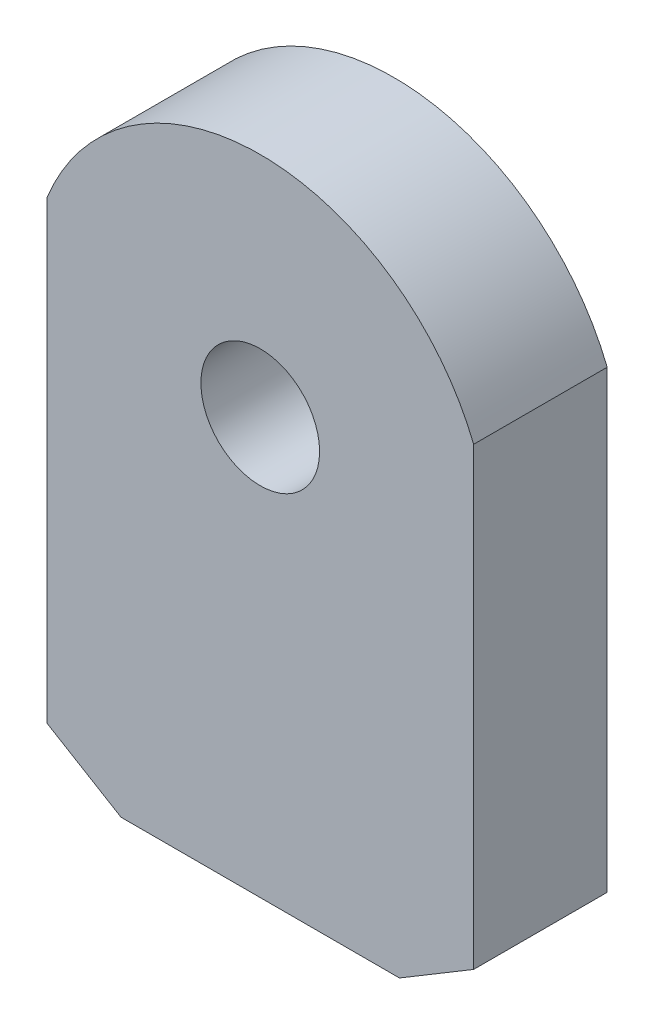
from build123d import *

# Parameters (mm, degrees)
SKETCH_1_R      = 4
EXTRUDE_1_DEPTH = 9
CHAMFER_1_SIZE  = 5
CHAMFER_1_SIZE2 = 3
CHAMFER_2_SIZE  = 3
CHAMFER_2_SIZE2 = 5


with BuildPart() as part:
    # ｽｹｯﾁ1 → ﾎﾞｽ - 押し出し1 (new body)
    with BuildSketch(Plane.XY):
        with BuildLine():
            Line((14.385, -28.04), (-14.385, -28.04))
            Line((-14.385, -28.04), (-14.385, -5.612501624))
            Line((-14.385, -5.612501624), (-14.385, 5.612501624))
            ThreePointArc((-14.385, 5.612501624), (0, 15.34), (14.385, 5.612501624))
            Line((14.385, 5.612501624), (14.385, -5.612501624))
            Line((14.385, -5.612501624), (14.385, -28.04))
        make_face()
        Circle(SKETCH_1_R, mode=Mode.SUBTRACT)
    extrude(amount=EXTRUDE_1_DEPTH)

    # 面取り1
    chamfer_1_edges = [part.edges().sort_by_distance(p)[0] for p in [
        (14.385, -28.04, 4.5),
    ]]
    chamfer_1_side = [part.faces().sort_by_distance(p)[0] for p in [
        (0, -28.04, 4.5),
    ]]
    chamfer(chamfer_1_edges, length=CHAMFER_1_SIZE, length2=CHAMFER_1_SIZE2, reference=chamfer_1_side[0])

    # 面取り2
    chamfer_2_edges = [part.edges().sort_by_distance(p)[0] for p in [
        (-14.385, -28.04, 4.5),
    ]]
    chamfer_2_side = [part.faces().sort_by_distance(p)[0] for p in [
        (-14.385, -11.213749188, 4.5),
    ]]
    chamfer(chamfer_2_edges, length=CHAMFER_2_SIZE, length2=CHAMFER_2_SIZE2, reference=chamfer_2_side[0])


solid = part.part
